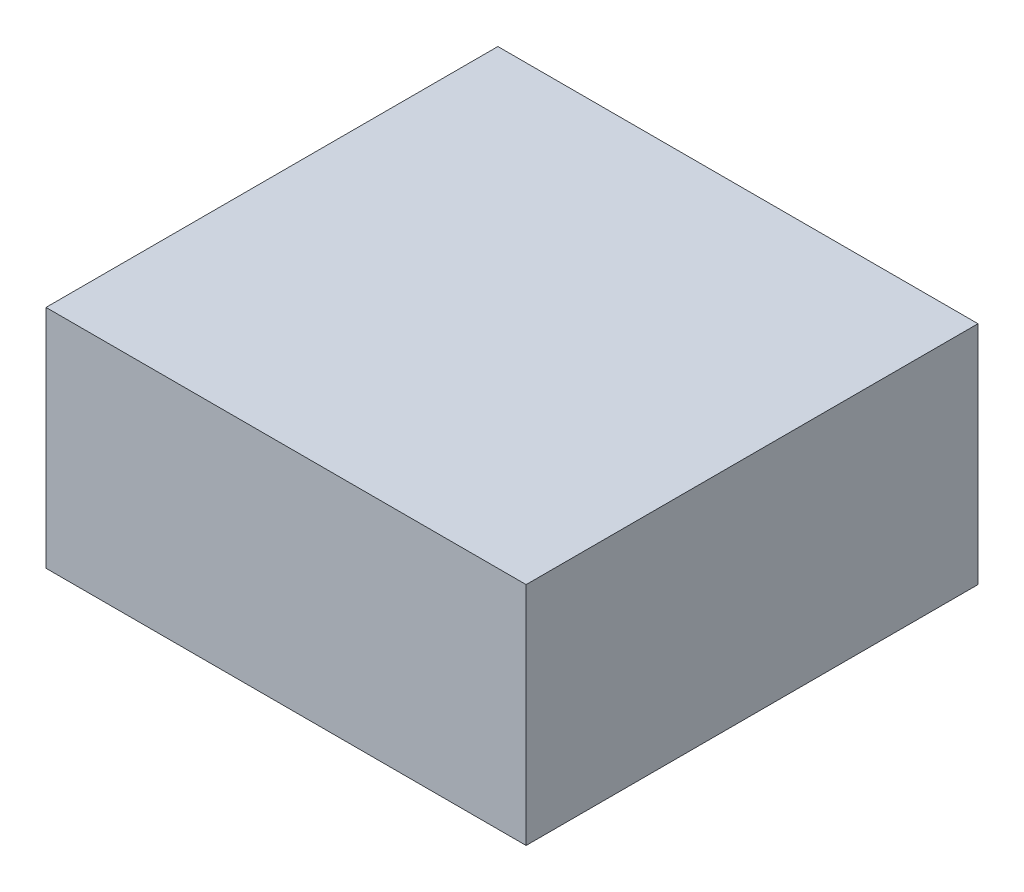
from build123d import *

# Parameters (mm, degrees)
SKETCH_1_W                   = 85
SKETCH_1_H                   = 40
SOLID_OBS_02_FRONT_BOX_DEPTH = 80


with BuildPart() as part:
    # 草图1 → solid_obs_02_front_box (new body)
    with BuildSketch(Plane.XY):
        Rectangle(SKETCH_1_W, SKETCH_1_H)
    extrude(amount=SOLID_OBS_02_FRONT_BOX_DEPTH)


solid = part.part
